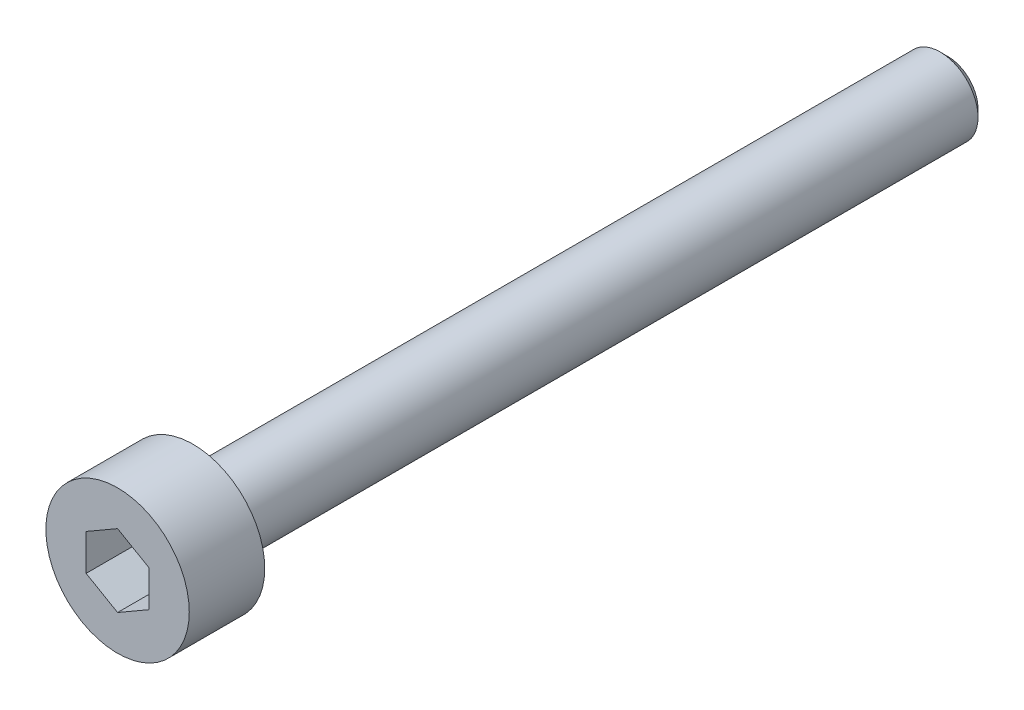
from build123d import *

# Parameters (mm, degrees)
SKETCH1_R           = 2.85
BOSS_EXTRUDE1_DEPTH = 3
SKETCH2_R           = 1.5
BOSS_EXTRUDE2_DEPTH = 30
CHAMFER1_SIZE       = 0.3
CUT_EXTRUDE1_DEPTH  = 2


with BuildPart() as part:
    # Sketch1 → Boss-Extrude1 (new body)
    with BuildSketch(Plane.XY):
        Circle(SKETCH1_R)
    extrude(amount=BOSS_EXTRUDE1_DEPTH)

    # Sketch2 → Boss-Extrude2 (add)
    with BuildSketch(Plane(origin=(0, 0, 0), x_dir=(-1, 0, 0), z_dir=(0, 0, -1))):
        with Locations(Location((0, 0, 0), (0, 0, 180))):
            Circle(SKETCH2_R)
    extrude(amount=BOSS_EXTRUDE2_DEPTH)

    # Chamfer1
    chamfer1_edges = [part.edges().sort_by_distance(p)[0] for p in [
        (-1.5, 0, -30),
    ]]
    chamfer(chamfer1_edges, length=CHAMFER1_SIZE)

    # Sketch3 → Cut-Extrude1 (cut)
    with BuildSketch(Plane.XY.offset(3)):
        Polygon((0, 1.443375673), (-1.25, 0.721687836), (-1.25, -0.721687836), (0, -1.443375673), (1.25, -0.721687836), (1.25, 0.721687836), align=None)
    extrude(amount=-CUT_EXTRUDE1_DEPTH, mode=Mode.SUBTRACT)


solid = part.part
